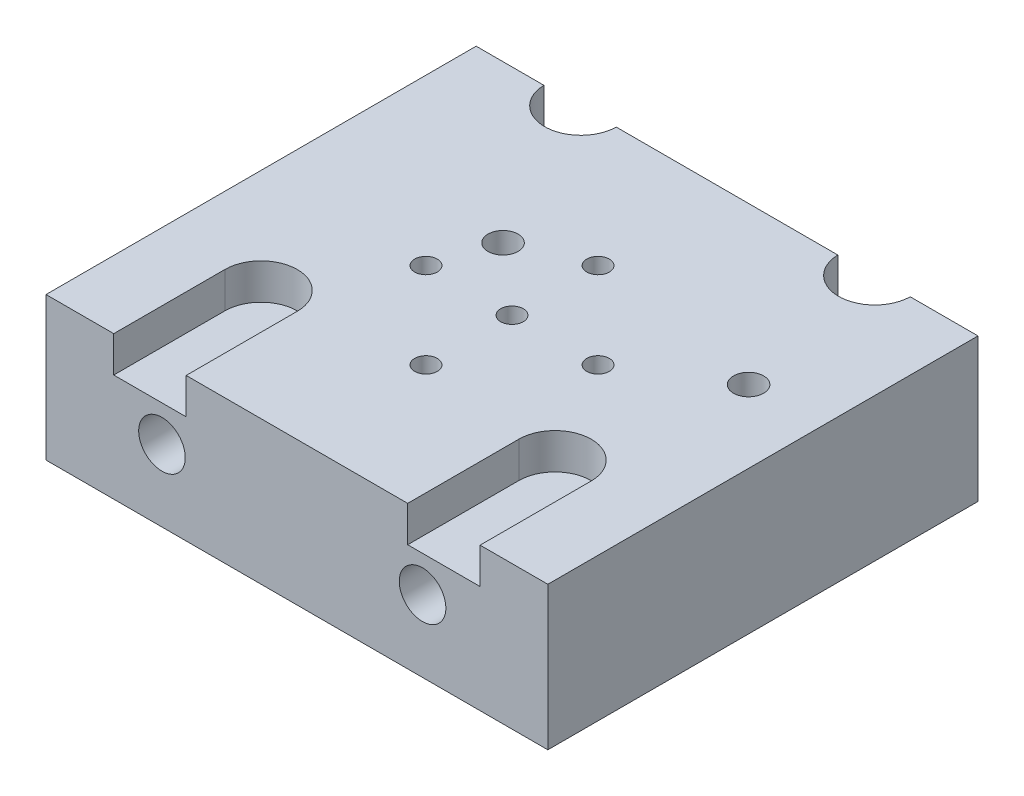
from build123d import *

# Parameters (mm, degrees)
SKETCH3_W           = 70
SKETCH3_H           = 60
BOSS_EXTRUDE3_DEPTH = 20
SKETCH4_R           = 1.575
CUT_EXTRUDE1_DEPTH  = 95.339811321
SKETCH6_R           = 2.1
CUT_EXTRUDE2_DEPTH  = 95.339811321
SKETCH9_R           = 3.25
CUT_EXTRUDE3_DEPTH  = 95.339811321
CUT_EXTRUDE4_START  = -3
SKETCH11_R          = 3
SKETCH11_R_2        = 1.575
CUT_EXTRUDE4_DEPTH  = 3
CHAMFER1_SIZE       = 0.8
SKETCH12_R          = 5.05
CUT_EXTRUDE5_DEPTH  = 5


with BuildPart() as part:
    # Sketch3 → Boss-Extrude3 (new body)
    with BuildSketch(Plane(origin=(0, 0, 0), x_dir=(1, 0, 0), z_dir=(0, 1, 0))):
        with Locations((35, -30)):
            Rectangle(SKETCH3_W, SKETCH3_H)
    extrude(amount=BOSS_EXTRUDE3_DEPTH)

    # Sketch4 → Cut-Extrude1 (cut, through all)
    with BuildSketch(Plane(origin=(0, 20, 0), x_dir=(1, 0, 0), z_dir=(0, 1, 0))):
        with Locations(Location((35, -30, 0), (0, 0, 270))):
            Circle(SKETCH4_R)
        with Locations(Location((35, -18, 0), (0, 0, 270))):
            Circle(SKETCH4_R)
        with Locations(Location((47, -30, 0), (0, 0, 270))):
            Circle(SKETCH4_R)
        with Locations(Location((35, -42, 0), (0, 0, 270))):
            Circle(SKETCH4_R)
        with Locations(Location((23, -30, 0), (0, 0, 270))):
            Circle(SKETCH4_R)
    extrude(amount=-CUT_EXTRUDE1_DEPTH, mode=Mode.SUBTRACT)

    # Sketch6 → Cut-Extrude2 (cut, through all)
    with BuildSketch(Plane.XZ):
        with Locations(Location((59.875, 21.875, 0), (0, 0, 270))):
            Circle(SKETCH6_R)
        with Locations(Location((25.625, 21.875, 0), (0, 0, 270))):
            Circle(SKETCH6_R)
    extrude(amount=-CUT_EXTRUDE2_DEPTH, mode=Mode.SUBTRACT)

    # Sketch9 → Cut-Extrude3 (cut, through all)
    with BuildSketch(Plane(origin=(0, 0, 0), x_dir=(-1, 0, 0), z_dir=(0, 0, -1))):
        with Locations((-52.525, 10)):
            Circle(SKETCH9_R)
        with Locations((-16.175, 10)):
            Circle(SKETCH9_R)
    extrude(amount=-CUT_EXTRUDE3_DEPTH, mode=Mode.SUBTRACT)

    # Sketch11 → Cut-Extrude4 (cut)
    # profile 1 of 10: a face of its own
    with BuildSketch(Plane.XZ.offset(CUT_EXTRUDE4_START)):
        with Locations(Location((35, 18, 0), (0, 0, 270))):
            Circle(SKETCH11_R)
        with Locations(Location((35, 18, 0), (0, 0, 90))):
            Circle(SKETCH11_R_2, mode=Mode.SUBTRACT)
    # profile 2 of 10: a face of its own
    with BuildSketch(Plane.XZ.offset(CUT_EXTRUDE4_START)):
        with Locations(Location((35, 30, 0), (0, 0, 270))):
            Circle(SKETCH11_R)
        with Locations(Location((35, 30, 0), (0, 0, 90))):
            Circle(SKETCH11_R_2, mode=Mode.SUBTRACT)
    # profile 3 of 10: a face of its own
    with BuildSketch(Plane.XZ.offset(CUT_EXTRUDE4_START)):
        with Locations(Location((47, 30, 0), (0, 0, 270))):
            Circle(SKETCH11_R)
        with Locations(Location((47, 30, 0), (0, 0, 90))):
            Circle(SKETCH11_R_2, mode=Mode.SUBTRACT)
    # profile 4 of 10: a face of its own
    with BuildSketch(Plane.XZ.offset(CUT_EXTRUDE4_START)):
        with Locations(Location((23, 30, 0), (0, 0, 270))):
            Circle(SKETCH11_R)
        with Locations(Location((23, 30, 0), (0, 0, 90))):
            Circle(SKETCH11_R_2, mode=Mode.SUBTRACT)
    # profile 5 of 10: a face of its own
    with BuildSketch(Plane.XZ.offset(CUT_EXTRUDE4_START)):
        with Locations(Location((35, 42, 0), (0, 0, 270))):
            Circle(SKETCH11_R)
        with Locations(Location((35, 42, 0), (0, 0, 90))):
            Circle(SKETCH11_R_2, mode=Mode.SUBTRACT)
    # profile 6 of 10: a face of its own
    with BuildSketch(Plane.XZ.offset(CUT_EXTRUDE4_START)):
        with Locations(Location((35, 42, 0), (0, 0, 90))):
            Circle(SKETCH11_R_2)
    # profile 7 of 10: a face of its own
    with BuildSketch(Plane.XZ.offset(CUT_EXTRUDE4_START)):
        with Locations(Location((23, 30, 0), (0, 0, 90))):
            Circle(SKETCH11_R_2)
    # profile 8 of 10: a face of its own
    with BuildSketch(Plane.XZ.offset(CUT_EXTRUDE4_START)):
        with Locations(Location((35, 30, 0), (0, 0, 90))):
            Circle(SKETCH11_R_2)
    # profile 9 of 10: a face of its own
    with BuildSketch(Plane.XZ.offset(CUT_EXTRUDE4_START)):
        with Locations(Location((47, 30, 0), (0, 0, 90))):
            Circle(SKETCH11_R_2)
    # profile 10 of 10: a face of its own
    with BuildSketch(Plane.XZ.offset(CUT_EXTRUDE4_START)):
        with Locations(Location((35, 18, 0), (0, 0, 90))):
            Circle(SKETCH11_R_2)
    extrude(amount=CUT_EXTRUDE4_DEPTH, mode=Mode.SUBTRACT)

    # Chamfer1
    chamfer1_edges = [part.edges().sort_by_distance(p)[0] for p in [
        (55.775, 10, 0),
        (19.425, 10, 0),
    ]]
    chamfer(chamfer1_edges, length=CHAMFER1_SIZE)

    # Sketch12 → Cut-Extrude5 (cut)
    with BuildSketch(Plane(origin=(0, 20, 0), x_dir=(1, 0, 0), z_dir=(0, 1, 0))):
        with Locations((14.5, 0.104949747)):
            Circle(SKETCH12_R)
        with Locations((55.5, 0.104949747)):
            Circle(SKETCH12_R)
        with BuildLine():
            Line((9.45, -60.104949747), (9.45, -44.5))
            ThreePointArc((9.45, -44.5), (14.5, -39.45), (19.55, -44.5))
            Line((19.55, -44.5), (19.55, -60.104949747))
            ThreePointArc((19.55, -60.104949747), (14.5, -65.154949747), (9.45, -60.104949747))
        make_face()
        with BuildLine():
            Line((60.55, -60.104949747), (60.55, -44.5))
            ThreePointArc((60.55, -44.5), (55.5, -39.45), (50.45, -44.5))
            Line((50.45, -44.5), (50.45, -60.104949747))
            ThreePointArc((50.45, -60.104949747), (55.5, -65.154949747), (60.55, -60.104949747))
        make_face()
    extrude(amount=-CUT_EXTRUDE5_DEPTH, mode=Mode.SUBTRACT)


solid = part.part
